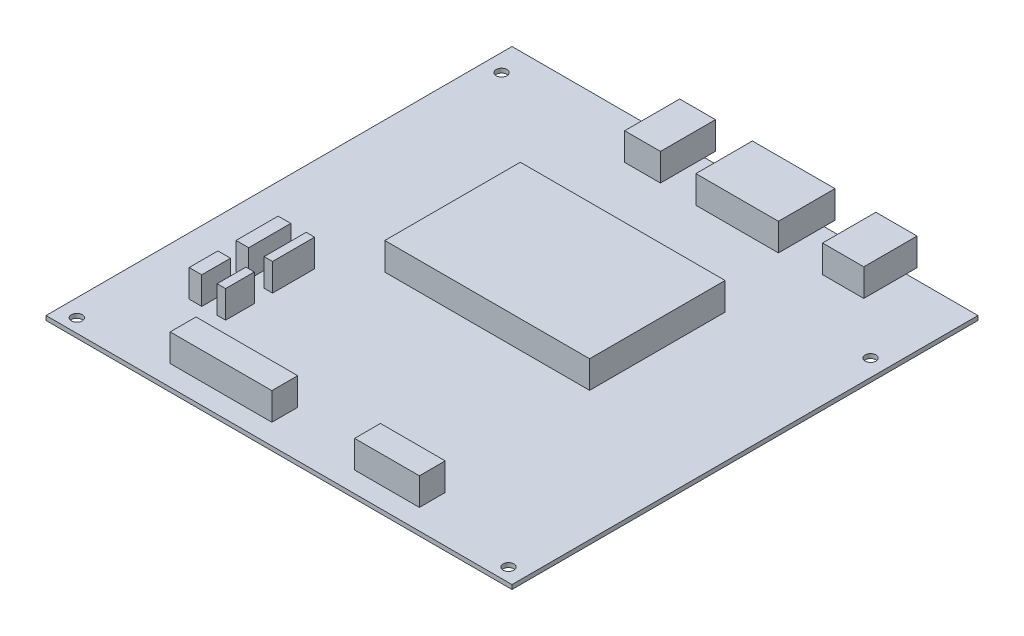
from build123d import *

# Parameters (mm, degrees)
SKICA1_W                 = 170
SKICA1_H                 = 170
P_IDAT_VYSUNUT_M1_DEPTH  = 1.57
SKICA2_R                 = 1.98
ODEBRAT_VYSUNUT_M1_DEPTH = 121.218404997
SKICA5_W                 = 74.714921367
SKICA5_H                 = 49.436852068
SKICA5_W_2               = 13.058822206
SKICA5_H_2               = 20.074329326
SKICA5_W_3               = 30.123299763
SKICA5_H_3               = 20.63009193
SKICA5_W_4               = 15.040102655
SKICA5_H_4               = 19.44386018
SKICA5_W_5               = 37.10064142
SKICA5_H_5               = 9.432366463
SKICA5_W_6               = 23.63246263
SKICA5_W_7               = 4.604120699
SKICA5_H_6               = 15.347068998
SKICA5_W_8               = 3.0694138
SKICA5_H_7               = 10.485045568
P_IDAT_VYSUNUT_M3_DEPTH  = 10


with BuildPart() as part:
    # Skica1 → Přidat vysunutím1 (new body)
    with BuildSketch(Plane(origin=(0, 0, 0), x_dir=(1, 0, 0), z_dir=(0, 1, 0))):
        Rectangle(SKICA1_W, SKICA1_H)
    extrude(amount=P_IDAT_VYSUNUT_M1_DEPTH)

    # Skica2 → Odebrat vysunutím1 (cut, through all)
    with BuildSketch(Plane(origin=(0, 1.57, 0), x_dir=(1, 0, 0), z_dir=(0, 1, 0))):
        with Locations(Location((-78.65, 74.84, 0), (0, 0, 270))):
            Circle(SKICA2_R)
        with Locations(Location((-78.65, -80.1, 0), (0, 0, 270))):
            Circle(SKICA2_R)
        with Locations(Location((78.83, -80.1, 0), (0, 0, 270))):
            Circle(SKICA2_R)
        with Locations(Location((78.83, 51.98, 0), (0, 0, 270))):
            Circle(SKICA2_R)
    extrude(amount=-ODEBRAT_VYSUNUT_M1_DEPTH, mode=Mode.SUBTRACT)

    # Skica5 → Přidat vysunutím3 (add)
    with BuildSketch(Plane(origin=(0, 1.57, 0), x_dir=(1, 0, 0), z_dir=(0, 1, 0))):
        with Locations((0.444909378, 15.224526197)):
            Rectangle(SKICA5_W, SKICA5_H)
        with Locations((-21.296441518, 78.962835337)):
            Rectangle(SKICA5_W_2, SKICA5_H_2)
        with Locations((13.764534228, 78.684954035)):
            Rectangle(SKICA5_W_3, SKICA5_H_3)
        with Locations((51.258042544, 79.27806991)):
            Rectangle(SKICA5_W_4, SKICA5_H_4)
        with Locations((-28.628364805, -72.809161969)):
            Rectangle(SKICA5_W_5, SKICA5_H_5)
        with Locations((31.921759901, -72.809161969)):
            Rectangle(SKICA5_W_6, SKICA5_H_5)
        with Locations((-61.75978641, -28.925932014)):
            Rectangle(SKICA5_W_7, SKICA5_H_6)
        with Locations((-52.295760528, -28.925932014)):
            Rectangle(SKICA5_W_8, SKICA5_H_6)
        with Locations((-61.75978641, -48.481841274)):
            Rectangle(SKICA5_W_7, SKICA5_H_7)
        with Locations((-52.295760528, -48.481841274)):
            Rectangle(SKICA5_W_8, SKICA5_H_7)
    extrude(amount=P_IDAT_VYSUNUT_M3_DEPTH)


solid = part.part
